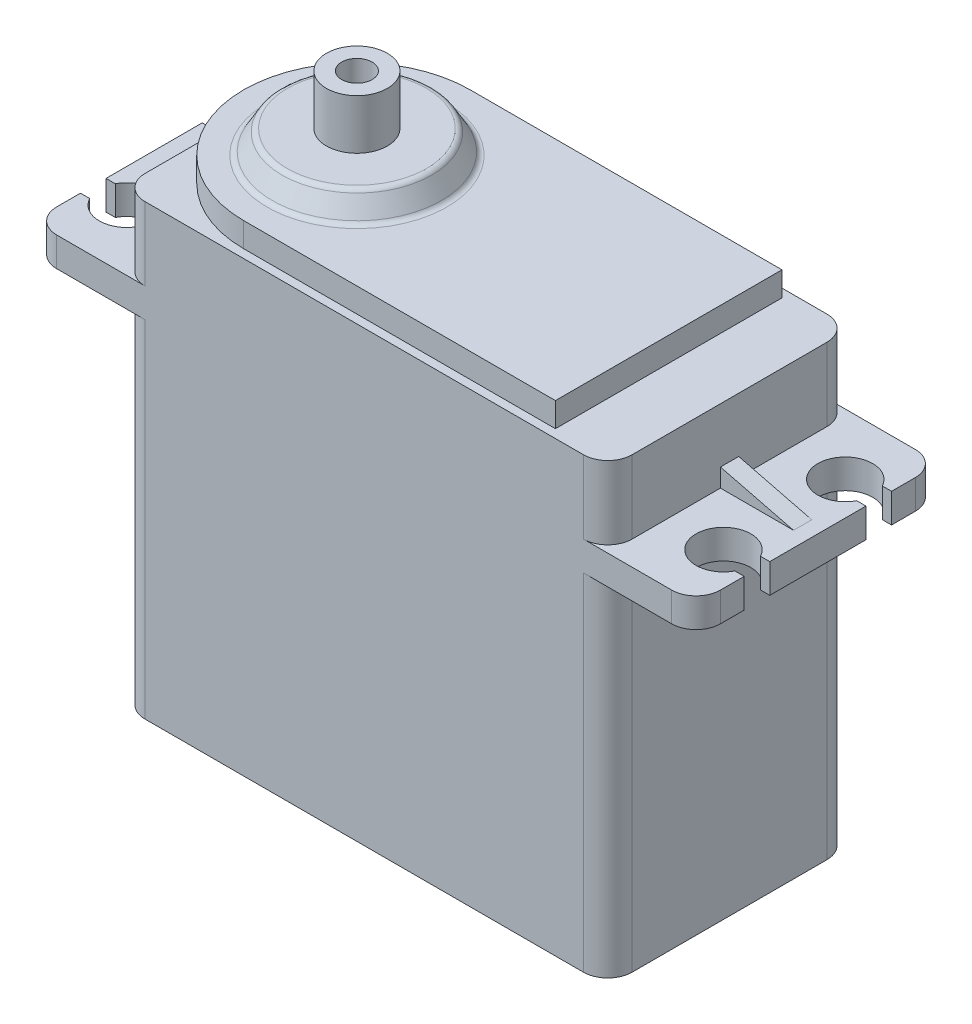
from build123d import *

# Parameters (mm, degrees)
EXTRUDE_1_DEPTH     = 10
EXTRUDE_START       = 30.8
SKETCH_4_W          = 54.5
SKETCH_4_H          = 20
EXTRUDE_2_DEPTH     = 2.4
SKETCH_5_R          = 2.25
CUT_EXTRUDE_1_DEPTH = 3.1
SKETCH_6_W          = 2
SKETCH_6_H          = 2.1
CUT_EXTRUDE_2_DEPTH = 3.1
SKETCH_8_R          = 6
EXTRUDE_3_DEPTH     = 1.9
EXTRUDE_3_DRAFT     = -30
SKETCH_9_R          = 2.5
EXTRUDE_4_DEPTH     = 4.1
SKETCH_10_R         = 1.25
CUT_EXTRUDE_3_DEPTH = 9
EXTRUDE_5_DEPTH     = 0.75
SKETCH_12_W         = 40
SKETCH_12_H         = 20
CUT_EXTRUDE_5_DEPTH = 2
FILLET_1_R          = 2
FILLET_2_R          = 0.5


with BuildPart() as part:
    # 草图3 → 凸台-拉伸1 (new, symmetric)
    with BuildSketch(Plane.XY):
        Polygon((-20, 0), (20, 0), (20, 35.1), (20, 38.8), (16, 38.8), (-13.8, 38.8), (-20, 38.8), (-20, 34.4), align=None)
    extrude(amount=EXTRUDE_1_DEPTH, both=True)

    # 草图4 → 凸台-拉伸2 (add)
    with BuildSketch(Plane(origin=(0, 0, 0), x_dir=(1, 0, 0), z_dir=(0, 1, 0)).offset(EXTRUDE_START)):
        Rectangle(SKETCH_4_W, SKETCH_4_H)
    extrude(amount=-EXTRUDE_2_DEPTH)

    # 草图5 → 切除-拉伸1 (cut)
    with BuildSketch(Plane(origin=(0, 30.8, 0), x_dir=(1, 0, 0), z_dir=(0, 1, 0))):
        with Locations(Location((-24.5, 5, 0), (0, 0, 270))):
            Circle(SKETCH_5_R)
        with Locations(Location((24.5, 5, 0), (0, 0, 270))):
            Circle(SKETCH_5_R)
        with Locations(Location((24.5, -5, 0), (0, 0, 270))):
            Circle(SKETCH_5_R)
        with Locations(Location((-24.5, -5, 0), (0, 0, 270))):
            Circle(SKETCH_5_R)
    extrude(amount=-CUT_EXTRUDE_1_DEPTH, mode=Mode.SUBTRACT)

    # 草图6 → 切除-拉伸2 (cut)
    with BuildSketch(Plane(origin=(0, 30.8, 0), x_dir=(1, 0, 0), z_dir=(0, 1, 0))):
        with Locations((-26.25, 5)):
            Rectangle(SKETCH_6_W, SKETCH_6_H)
        with Locations((26.25, 5)):
            Rectangle(SKETCH_6_W, SKETCH_6_H)
        with Locations((26.25, -5)):
            Rectangle(SKETCH_6_W, SKETCH_6_H)
        with Locations((-26.25, -5)):
            Rectangle(SKETCH_6_W, SKETCH_6_H)
    extrude(amount=-CUT_EXTRUDE_2_DEPTH, mode=Mode.SUBTRACT)


with BuildPart() as extrude_3_tool:
    # 草图8 → 凸台-拉伸3 (with draft: the straight prism first)
    with BuildSketch(Plane.XZ.offset(-40.7)):
        with Locations((-10.6, 0)):
            Circle(SKETCH_8_R)
    extrude(amount=EXTRUDE_3_DEPTH)
    # 凸台-拉伸3: the draft: its side faces are tilted about the plane it starts from
    extrude_3_sides = [extrude_3_tool.faces().sort_by_distance(p)[0] for p in [
        (-16.6, 39.75, 0),
    ]]
    draft(extrude_3_sides, Plane.XZ.offset(-40.7), EXTRUDE_3_DRAFT)


with BuildPart() as part_1:
    add(part.part)

    # 凸台-拉伸3: add extrude_3_tool
    add(extrude_3_tool.part)

    # 草图9 → 凸台-拉伸4 (add)
    with BuildSketch(Plane(origin=(0, 40.7, 0), x_dir=(1, 0, 0), z_dir=(0, 1, 0))):
        with Locations(Location((-10.6, 0, 0), (0, 0, 90))):
            Circle(SKETCH_9_R)
    extrude(amount=EXTRUDE_4_DEPTH)

    # 草图10 → 切除-拉伸3 (cut)
    with BuildSketch(Plane(origin=(0, 44.8, 0), x_dir=(1, 0, 0), z_dir=(0, 1, 0))):
        with Locations(Location((-10.6, 0, 0), (0, 0, 270))):
            Circle(SKETCH_10_R)
    extrude(amount=-CUT_EXTRUDE_3_DEPTH, mode=Mode.SUBTRACT)

    # 草图11 → 凸台-拉伸5 (add, symmetric)
    with BuildSketch(Plane.XY):
        Polygon((-20, 32.3), (-26, 30.8), (-20, 30.8), align=None)
        Polygon((20, 30.8), (20, 32.3), (26, 30.8), align=None)
    extrude(amount=EXTRUDE_5_DEPTH, both=True)

    # 草图12 → 切除-拉伸5 (cut)
    with BuildSketch(Plane(origin=(0, 38.8, 0), x_dir=(1, 0, 0), z_dir=(0, 1, 0))):
        Rectangle(SKETCH_12_W, SKETCH_12_H)
        with BuildLine():
            Line((-10.6, 9.3), (15, 9.3))
            Line((15, 9.3), (15, -9.3))
            Line((15, -9.3), (-10.6, -9.3))
            ThreePointArc((-10.6, -9.3), (-19.9, 0), (-10.6, 9.3))
        make_face(mode=Mode.SUBTRACT)
    extrude(amount=-CUT_EXTRUDE_5_DEPTH, mode=Mode.SUBTRACT)

    # 圆角1
    fillet_1_edges = [part_1.edges().sort_by_distance(p)[0] for p in [
        (20, 14.2, 10),
        (-20, 33.8, -10),
        (-20, 33.8, 10),
        (-20, 14.2, -10),
        (20, 33.8, -10),
        (-20, 14.2, 10),
        (20, 33.8, 10),
        (27.25, 29.6, 10),
        (-27.25, 29.6, -10),
        (27.25, 29.6, -10),
        (-27.25, 29.6, 10),
        (20, 14.2, -10),
    ]]
    fillet(fillet_1_edges, radius=FILLET_1_R)

    # 圆角2
    fillet_2_edges = [part_1.edges().sort_by_distance(p)[0] for p in [
        (-17.696965511, 38.8, 0),
        (-16.6, 40.7, 0),
    ]]
    fillet(fillet_2_edges, radius=FILLET_2_R)


solid = part_1.part
